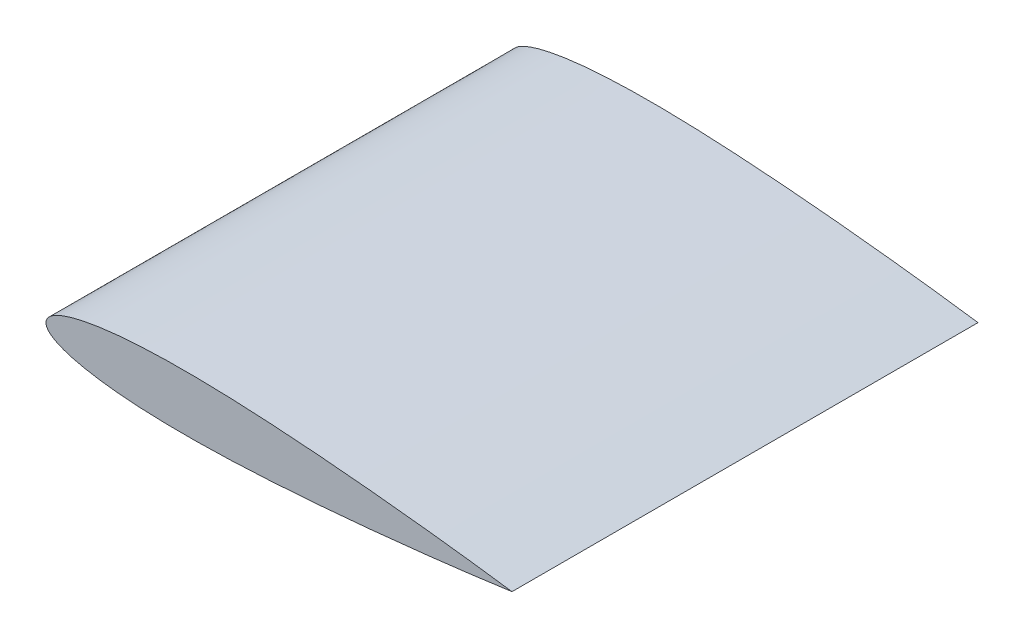
from build123d import *

# Parameters (mm, degrees)
BOSS_EXTRUDE1_DEPTH = 0.5
SCALE1_SCALE        = 1000


with BuildPart() as part:
    # Sketch1 → Boss-Extrude1 (new, symmetric)
    with BuildSketch(Plane(origin=(0, 0, 0), x_dir=(-1, 0, 0), z_dir=(0, 0, -1))):
        with BuildLine():
            add(Edge.make_bspline(
                [(0, 0), (-5.5e-08, 0.000888466), (0.000147782, 0.002843842), (0.000947089, 0.006041247), (0.002941878, 0.009713487), (0.006774101, 0.014457085), (0.012556949, 0.019216186), (0.021110429, 0.024428475), (0.034866193, 0.03059158), (0.055431204, 0.037455368), (0.089828348, 0.04550977), (0.139755341, 0.052902373), (0.203428826, 0.057926975), (0.27656322, 0.060001118), (0.353340263, 0.059233405), (0.429257805, 0.056493131), (0.506378652, 0.05199658), (0.581338667, 0.046568611), (0.659622586, 0.039668579), (0.732235268, 0.032719991), (0.813983542, 0.023695093), (0.880399061, 0.016071042), (0.949075665, 0.007054301), (0.982784205, 0.002442523), (1, 0)],
                knots=[0, 0, 0, 0, 0, 0.003158851, 0.007000711, 0.011625702, 0.014778643, 0.02484247, 0.03354265, 0.047310358, 0.068440823, 0.102185964, 0.159338811, 0.227557949, 0.295777086, 0.363996223, 0.432215362, 0.5004345, 0.568653639, 0.636872777, 0.705091915, 0.773311052, 0.84153019, 0.90974933, 0.90974933, 0.90974933, 0.90974933, 0.90974933], degree=4))
            add(Edge.make_bspline(
                [(0, 0), (-5.5e-08, -0.000888466), (0.000147782, -0.002843842), (0.000947089, -0.006041247), (0.002941878, -0.009713487), (0.006774101, -0.014457085), (0.012556949, -0.019216186), (0.021110429, -0.024428475), (0.034866193, -0.03059158), (0.055431204, -0.037455368), (0.089828348, -0.04550977), (0.139755341, -0.052902373), (0.203428826, -0.057926975), (0.27656322, -0.060001118), (0.353340263, -0.059233405), (0.429257805, -0.056493131), (0.506378652, -0.05199658), (0.581338667, -0.046568611), (0.659622586, -0.039668579), (0.732235268, -0.032719991), (0.813983542, -0.023695093), (0.880399061, -0.016071042), (0.949075665, -0.007054301), (0.982784205, -0.002442523), (1, 0)],
                knots=[0, 0, 0, 0, 0, 0.003158851, 0.007000711, 0.011625702, 0.014778643, 0.02484247, 0.03354265, 0.047310358, 0.068440823, 0.102185964, 0.159338811, 0.227557949, 0.295777086, 0.363996223, 0.432215362, 0.5004345, 0.568653639, 0.636872777, 0.705091915, 0.773311052, 0.84153019, 0.90974933, 0.90974933, 0.90974933, 0.90974933, 0.90974933], degree=4))
        make_face()
    extrude(amount=BOSS_EXTRUDE1_DEPTH, both=True)


with BuildPart() as part_1:
    # Scale1: scaled about (0, 0, 0)
    add(part.part.scale(SCALE1_SCALE))


with BuildPart() as body_2:
    # Mirror2: mirrored copy
    add(part_1.part.mirror(Plane(origin=(0, 0, 0), x_dir=(0, 0, 1), z_dir=(1, 0, 0))))


with BuildPart() as body_2_1:
    # Body-Move/Copy1: moved
    add(body_2.part.moved(Location((-500, 0, 0))))


solid = body_2_1.part
